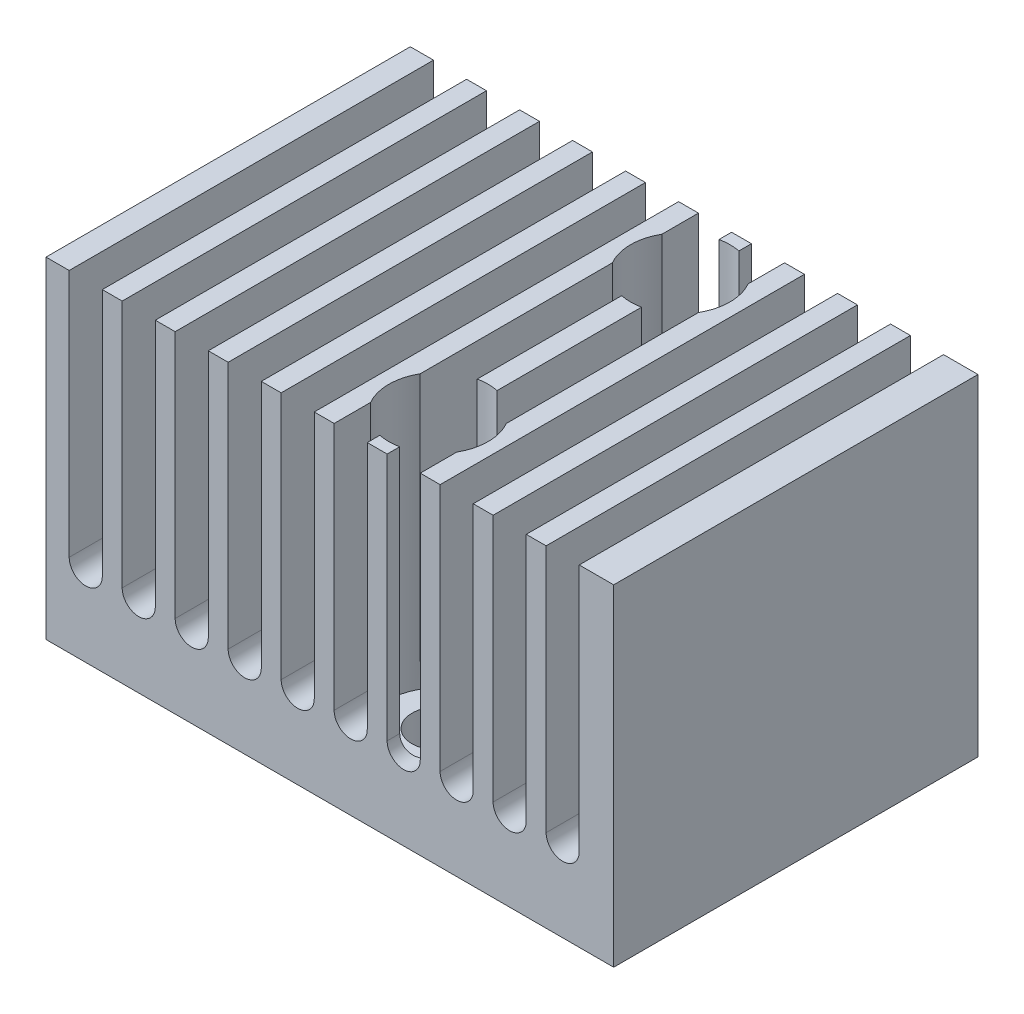
from build123d import *

# Parameters (mm, degrees)
SKETCH_1_W          = 17.14
SKETCH_1_H          = 11
EXTRUDE_1_DEPTH     = 10
CUT_EXTRUDE_1_DEPTH = 18.159396843
CUT_EXTRUDE_2_DEPTH = 1.75
SKETCH_4_R          = 1.5
CUT_EXTRUDE_3_DEPTH = 14.105624747


with BuildPart() as part:
    # 草图1 → 凸台-拉伸1 (new body)
    with BuildSketch(Plane(origin=(0, 0, 0), x_dir=(1, 0, 0), z_dir=(0, 1, 0))):
        Rectangle(SKETCH_1_W, SKETCH_1_H)
    extrude(amount=EXTRUDE_1_DEPTH)

    # 草图2 → 切除-拉伸1 (cut, through all)
    with BuildSketch(Plane.XY.offset(5.5)):
        with BuildLine():
            Line((-6.87, 10), (-7.87, 10))
            Line((-7.87, 10), (-7.87, 2.5))
            ThreePointArc((-7.87, 2.5), (-7.37, 3), (-6.87, 2.5))
            Line((-6.87, 2.5), (-6.87, 10))
        make_face()
        with BuildLine():
            Line((-5.27, 10), (-6.27, 10))
            Line((-6.27, 10), (-6.27, 2.5))
            ThreePointArc((-6.27, 2.5), (-5.77, 3), (-5.27, 2.5))
            Line((-5.27, 2.5), (-5.27, 10))
        make_face()
        with BuildLine():
            ThreePointArc((-6.87, 2.5), (-7.37, 3), (-7.87, 2.5))
            Line((-7.87, 2.5), (-6.87, 2.5))
        make_face()
        with BuildLine():
            Line((-6.87, 2.5), (-7.87, 2.5))
            ThreePointArc((-7.87, 2.5), (-7.37, 2), (-6.87, 2.5))
        make_face()
        with BuildLine():
            ThreePointArc((-5.27, 2.5), (-5.77, 3), (-6.27, 2.5))
            Line((-6.27, 2.5), (-5.27, 2.5))
        make_face()
        with BuildLine():
            Line((-5.27, 2.5), (-6.27, 2.5))
            ThreePointArc((-6.27, 2.5), (-5.77, 2), (-5.27, 2.5))
        make_face()
        with BuildLine():
            Line((-3.67, 10), (-4.67, 10))
            Line((-4.67, 10), (-4.67, 2.5))
            ThreePointArc((-4.67, 2.5), (-4.17, 3), (-3.67, 2.5))
            Line((-3.67, 2.5), (-3.67, 10))
        make_face()
        with BuildLine():
            ThreePointArc((-3.67, 2.5), (-4.17, 3), (-4.67, 2.5))
            Line((-4.67, 2.5), (-3.67, 2.5))
        make_face()
        with BuildLine():
            Line((-3.67, 2.5), (-4.67, 2.5))
            ThreePointArc((-4.67, 2.5), (-4.17, 2), (-3.67, 2.5))
        make_face()
        with BuildLine():
            Line((-2.07, 10), (-3.07, 10))
            Line((-3.07, 10), (-3.07, 2.5))
            ThreePointArc((-3.07, 2.5), (-2.57, 3), (-2.07, 2.5))
            Line((-2.07, 2.5), (-2.07, 10))
        make_face()
        with BuildLine():
            ThreePointArc((-2.07, 2.5), (-2.57, 3), (-3.07, 2.5))
            Line((-3.07, 2.5), (-2.07, 2.5))
        make_face()
        with BuildLine():
            Line((-2.07, 2.5), (-3.07, 2.5))
            ThreePointArc((-3.07, 2.5), (-2.57, 2), (-2.07, 2.5))
        make_face()
        with BuildLine():
            Line((-0.47, 10), (-1.47, 10))
            Line((-1.47, 10), (-1.47, 2.5))
            ThreePointArc((-1.47, 2.5), (-0.97, 3), (-0.47, 2.5))
            Line((-0.47, 2.5), (-0.47, 10))
        make_face()
        with BuildLine():
            ThreePointArc((-0.47, 2.5), (-0.97, 3), (-1.47, 2.5))
            Line((-1.47, 2.5), (-0.47, 2.5))
        make_face()
        with BuildLine():
            Line((-0.47, 2.5), (-1.47, 2.5))
            ThreePointArc((-1.47, 2.5), (-0.97, 2), (-0.47, 2.5))
        make_face()
        with BuildLine():
            Line((1.13, 10), (0.13, 10))
            Line((0.13, 10), (0.13, 2.5))
            ThreePointArc((0.13, 2.5), (0.63, 3), (1.13, 2.5))
            Line((1.13, 2.5), (1.13, 10))
        make_face()
        with BuildLine():
            ThreePointArc((1.13, 2.5), (0.63, 3), (0.13, 2.5))
            Line((0.13, 2.5), (1.13, 2.5))
        make_face()
        with BuildLine():
            Line((1.13, 2.5), (0.13, 2.5))
            ThreePointArc((0.13, 2.5), (0.63, 2), (1.13, 2.5))
        make_face()
        with BuildLine():
            Line((2.73, 10), (1.73, 10))
            Line((1.73, 10), (1.73, 2.5))
            ThreePointArc((1.73, 2.5), (2.23, 3), (2.73, 2.5))
            Line((2.73, 2.5), (2.73, 10))
        make_face()
        with BuildLine():
            ThreePointArc((2.73, 2.5), (2.23, 3), (1.73, 2.5))
            Line((1.73, 2.5), (2.73, 2.5))
        make_face()
        with BuildLine():
            Line((2.73, 2.5), (1.73, 2.5))
            ThreePointArc((1.73, 2.5), (2.23, 2), (2.73, 2.5))
        make_face()
        with BuildLine():
            Line((4.33, 10), (3.33, 10))
            Line((3.33, 10), (3.33, 2.5))
            ThreePointArc((3.33, 2.5), (3.83, 3), (4.33, 2.5))
            Line((4.33, 2.5), (4.33, 10))
        make_face()
        with BuildLine():
            ThreePointArc((4.33, 2.5), (3.83, 3), (3.33, 2.5))
            Line((3.33, 2.5), (4.33, 2.5))
        make_face()
        with BuildLine():
            Line((4.33, 2.5), (3.33, 2.5))
            ThreePointArc((3.33, 2.5), (3.83, 2), (4.33, 2.5))
        make_face()
        with BuildLine():
            Line((5.93, 10), (4.93, 10))
            Line((4.93, 10), (4.93, 2.5))
            ThreePointArc((4.93, 2.5), (5.43, 3), (5.93, 2.5))
            Line((5.93, 2.5), (5.93, 10))
        make_face()
        with BuildLine():
            ThreePointArc((5.93, 2.5), (5.43, 3), (4.93, 2.5))
            Line((4.93, 2.5), (5.93, 2.5))
        make_face()
        with BuildLine():
            Line((5.93, 2.5), (4.93, 2.5))
            ThreePointArc((4.93, 2.5), (5.43, 2), (5.93, 2.5))
        make_face()
        with BuildLine():
            Line((7.53, 10), (6.53, 10))
            Line((6.53, 10), (6.53, 2.5))
            ThreePointArc((6.53, 2.5), (7.03, 3), (7.53, 2.5))
            Line((7.53, 2.5), (7.53, 10))
        make_face()
        with BuildLine():
            ThreePointArc((7.53, 2.5), (7.03, 3), (6.53, 2.5))
            Line((6.53, 2.5), (7.53, 2.5))
        make_face()
        with BuildLine():
            Line((7.53, 2.5), (6.53, 2.5))
            ThreePointArc((6.53, 2.5), (7.03, 2), (7.53, 2.5))
        make_face()
    extrude(amount=-CUT_EXTRUDE_1_DEPTH, mode=Mode.SUBTRACT)

    # 草图3 → 切除-拉伸2 (cut)
    with BuildSketch(Plane.XZ):
        with BuildLine():
            ThreePointArc((2.23, 3.65), (1.995685425, 4.215685425), (1.43, 4.45))
            Line((1.43, 4.45), (1.43, 2.85))
            ThreePointArc((1.43, 2.85), (1.995685425, 3.084314575), (2.23, 3.65))
        make_face()
        with BuildLine():
            Line((1.43, 2.85), (1.43, 4.45))
            ThreePointArc((1.43, 4.45), (0.63, 3.65), (1.43, 2.85))
        make_face()
        with BuildLine():
            ThreePointArc((2.23, -3.65), (1.995685425, -3.084314575), (1.43, -2.85))
            Line((1.43, -2.85), (1.43, -4.45))
            ThreePointArc((1.43, -4.45), (1.995685425, -4.215685425), (2.23, -3.65))
        make_face()
        with BuildLine():
            Line((1.43, -4.45), (1.43, -2.85))
            ThreePointArc((1.43, -2.85), (0.63, -3.65), (1.43, -4.45))
        make_face()
    extrude(amount=-CUT_EXTRUDE_2_DEPTH, mode=Mode.SUBTRACT)

    # 草图4 → 切除-拉伸3 (cut, through all)
    with BuildSketch(Plane.XZ.offset(-1.75)):
        with Locations(Location((1.43, 3.65, 0), (0, 0, 270))):
            Circle(SKETCH_4_R)
        with Locations(Location((1.43, -3.65, 0), (0, 0, 270))):
            Circle(SKETCH_4_R)
    extrude(amount=-CUT_EXTRUDE_3_DEPTH, mode=Mode.SUBTRACT)


solid = part.part
